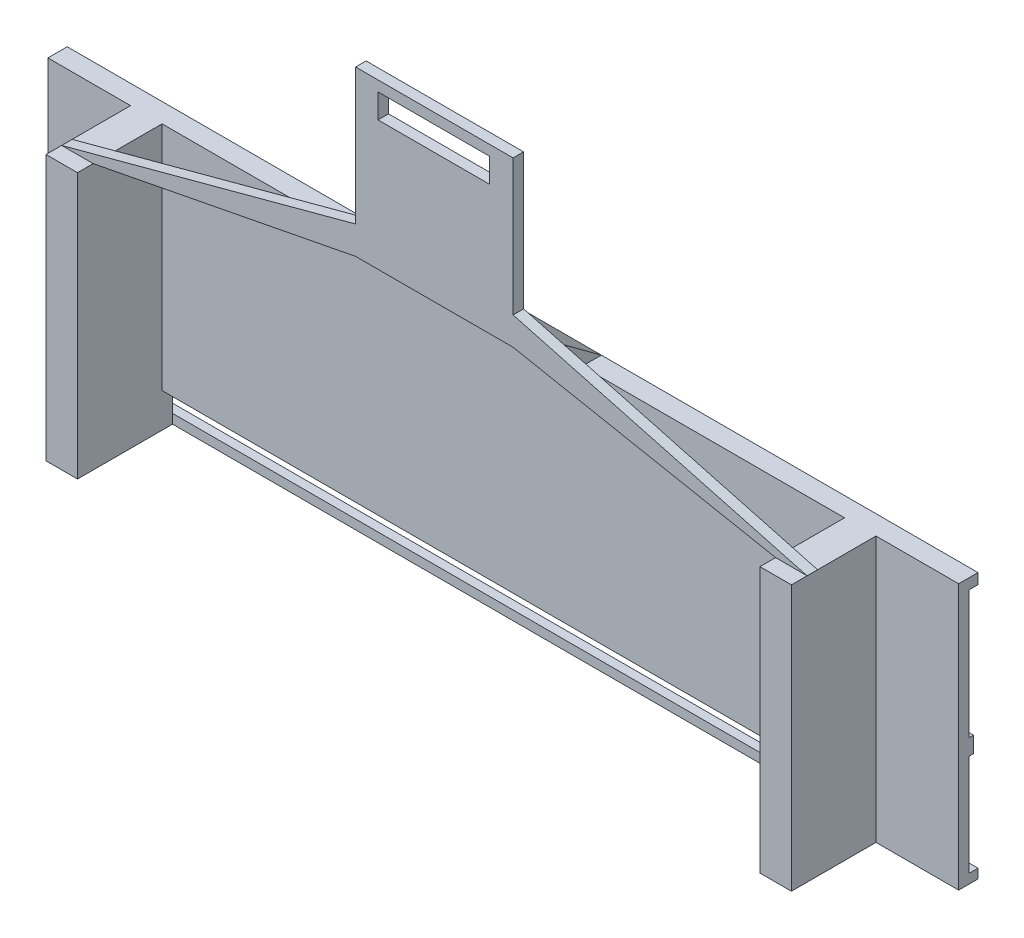
from build123d import *

# Parameters (mm, degrees)
SKETCH1_W           = 165.1
SKETCH1_H           = 55.88
BOSS_EXTRUDE1_DEPTH = 2.54
SKETCH1_3_W         = 7.62
SKETCH1_3_H         = 55.88
BOSS_EXTRUDE2_DEPTH = 20
BOSS_EXTRUDE3_DEPTH = 64.2
BOSS_EXTRUDE4_REACH = 127.654
SKETCH3_W           = 2.139816337
SKETCH3_H           = 2.547064604
SKETCH3_H_2         = 2.262901763
SKETCH3_W_2         = 1.069908168
SKETCH3_H_3         = 3.883558818
BOSS_EXTRUDE5_DEPTH = 19.05
BOSS_EXTRUDE6_DEPTH = 2.54
SKETCH6_W           = 26.96027589
SKETCH6_H           = 5.867824753
CUT_EXTRUDE1_DEPTH  = 222.886131721


with BuildPart() as part:
    # Sketch1 → Boss-Extrude1 (new body)
    with BuildSketch(Plane.XY):
        with Locations((82.55, 27.94)):
            Rectangle(SKETCH1_W, SKETCH1_H)
    extrude(amount=BOSS_EXTRUDE1_DEPTH)

    # Sketch1<3> → Boss-Extrude2 (add)
    with BuildSketch(Plane.XY):
        with Locations((-3.81, 27.94)):
            Rectangle(SKETCH1_3_W, SKETCH1_3_H)
        with Locations((168.91, 27.94)):
            Rectangle(SKETCH1_3_W, SKETCH1_3_H)
    extrude(amount=BOSS_EXTRUDE2_DEPTH)

    # Sketch2 → Boss-Extrude3 (add)
    with BuildSketch(Plane(origin=(0, 55.88, 0), x_dir=(1, 0, 0), z_dir=(0, 1, 0))):
        Polygon((165.1, 0), (192.72, 0), (192.72, -2.54), (172.72, -2.54), (172.72, -23), (165.1, -23), align=None)
    boss_extrude3 = extrude(amount=-BOSS_EXTRUDE3_DEPTH)

    # Boss-Extrude4: up to this face of the body (flat: up to its plane)
    boss_extrude4_end = Plane(part.part.faces().sort_by_distance((192.72, 23.78, 1.27))[0])
    # Sketch3 → Boss-Extrude4 (add, up to the picked face)
    with BuildSketch(Plane(origin=(82.55, 0, 0), x_dir=(0, 0, -1), z_dir=(1, 0, 0)), mode=Mode.PRIVATE) as boss_extrude4_sk1:
        with Locations((1.069908169, 54.606467698)):
            Rectangle(SKETCH3_W, SKETCH3_H)
    boss_extrude4_tool1 = split(extrude(boss_extrude4_sk1.sketch, amount=BOSS_EXTRUDE4_REACH, mode=Mode.PRIVATE), bisect_by=boss_extrude4_end, keep=Keep.BOTH, mode=Mode.PRIVATE)
    # Sketch3 → Boss-Extrude4 (add, up to the picked face)
    with BuildSketch(Plane(origin=(82.55, 0, 0), x_dir=(0, 0, -1), z_dir=(1, 0, 0)), mode=Mode.PRIVATE) as boss_extrude4_sk2:
        with Locations((1.069908169, -7.188549119)):
            Rectangle(SKETCH3_W, SKETCH3_H_2)
    boss_extrude4_tool2 = split(extrude(boss_extrude4_sk2.sketch, amount=BOSS_EXTRUDE4_REACH, mode=Mode.PRIVATE), bisect_by=boss_extrude4_end, keep=Keep.BOTH, mode=Mode.PRIVATE)
    # Sketch3 → Boss-Extrude4 (add, up to the picked face)
    with BuildSketch(Plane(origin=(82.55, 0, 0), x_dir=(0, 0, -1), z_dir=(1, 0, 0)), mode=Mode.PRIVATE) as boss_extrude4_sk3:
        with Locations((0.534954084, 20.417406389)):
            Rectangle(SKETCH3_W_2, SKETCH3_H_3)
    boss_extrude4_tool3 = split(extrude(boss_extrude4_sk3.sketch, amount=BOSS_EXTRUDE4_REACH, mode=Mode.PRIVATE), bisect_by=boss_extrude4_end, keep=Keep.BOTH, mode=Mode.PRIVATE)
    boss_extrude4_1 = boss_extrude4_tool1.solids().sort_by(Axis((82.55, 54.606468, -1.069908), (1, 0, 0)))[0]
    add(boss_extrude4_1)
    boss_extrude4_2 = boss_extrude4_tool2.solids().sort_by(Axis((82.55, -7.188549, -1.069908), (1, 0, 0)))[0]
    add(boss_extrude4_2)
    boss_extrude4_3 = boss_extrude4_tool3.solids().sort_by(Axis((82.55, 20.417406, -0.534954), (1, 0, 0)))[0]
    add(boss_extrude4_3)
    boss_extrude4 = boss_extrude4_1 + boss_extrude4_2 + boss_extrude4_3  # Boss-Extrude4 as one shape, for the pattern or mirror that repeats it

    # Mirror1: Boss-Extrude3, Boss-Extrude4 across plane
    add(boss_extrude3.mirror(Plane(origin=(82.55, 0, 0), x_dir=(0, 0, 1), z_dir=(1, 0, 0))))
    add(boss_extrude4.mirror(Plane(origin=(82.55, 0, 0), x_dir=(0, 0, 1), z_dir=(1, 0, 0))))

    # Sketch4 → Boss-Extrude5 (add, symmetric)
    with BuildSketch(Plane(origin=(82.55, 0, 0), x_dir=(0, 0, -1), z_dir=(1, 0, 0))):
        Polygon((-19.210834703, 68.192686786), (-2.54, 55.88), (2.139816337, 55.88), (-16.670834703, 69.773104851), (-16.670834703, 107.873104851), (-19.210834703, 107.873104851), align=None)
    extrude(amount=BOSS_EXTRUDE5_DEPTH, both=True)

    # Sketch5 → Boss-Extrude6 (add)
    with BuildSketch(Plane.XY.offset(19.210834703)):
        Polygon((63.5, 68.192686786), (0, 55.88), (-7.62, 55.88), (63.5, 74.973238457), align=None)
        Polygon((101.6, 74.973238457), (101.6, 68.192686786), (165.1, 55.88), (172.72, 55.88), align=None)
    extrude(amount=-BOSS_EXTRUDE6_DEPTH)

    # Sketch6 → Cut-Extrude1 (cut, through all)
    with BuildSketch(Plane.XY.offset(19.210834703)):
        with Locations((82.391410142, 102.430230737)):
            Rectangle(SKETCH6_W, SKETCH6_H)
    extrude(amount=-CUT_EXTRUDE1_DEPTH, mode=Mode.SUBTRACT)


solid = part.part
